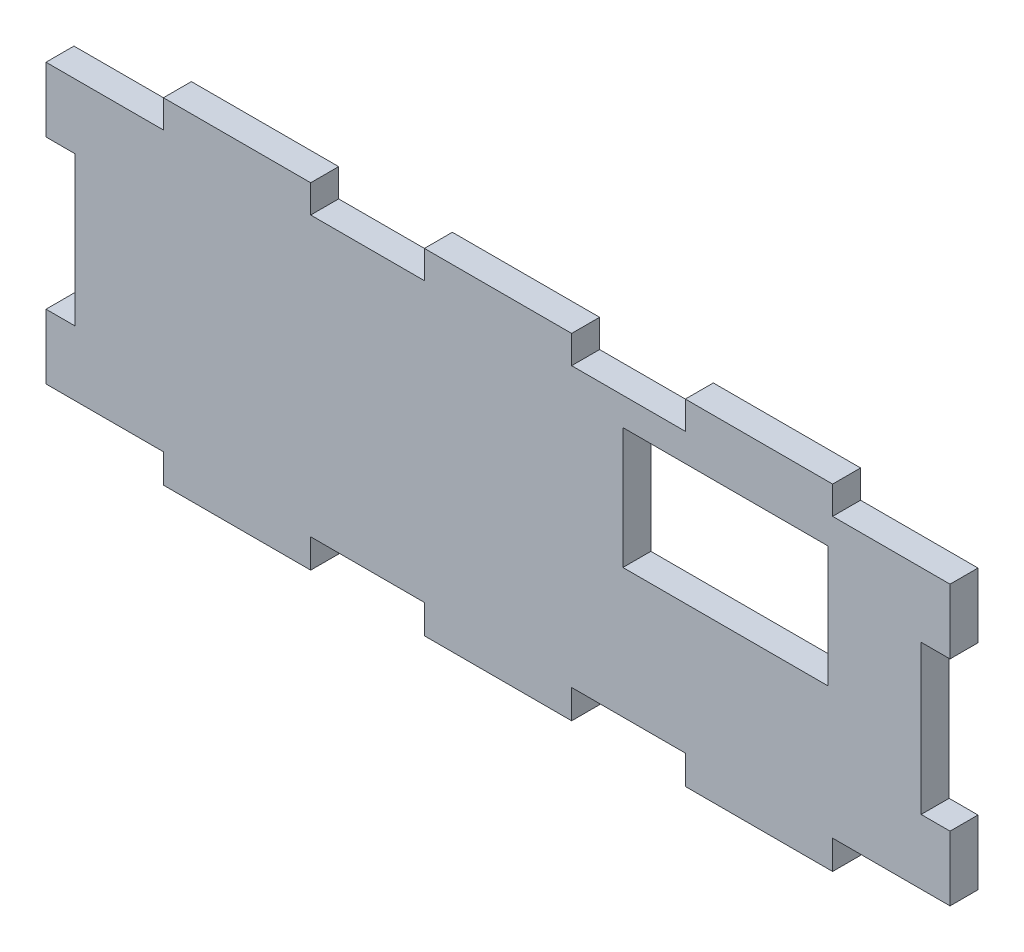
from build123d import *

# Parameters (mm, degrees)
SKETCH1_W           = 22
SKETCH1_H           = 13
BOSS_EXTRUDE1_DEPTH = 3


with BuildPart() as part:
    # Sketch1 → Boss-Extrude1 (new body)
    with BuildSketch(Plane.XY):
        Polygon((0, 29.9), (12.6, 29.9), (12.6, 32.9), (28.4, 32.9), (28.4, 29.9), (40.6, 29.9), (40.6, 32.9), (56.4, 32.9), (56.4, 29.9), (68.6, 29.9), (68.6, 32.9), (84.4, 32.9), (84.4, 29.9), (97, 29.9), (97, 22.95), (93.9, 22.95), (93.9, 6.95), (97, 6.95), (97, 0), (84.4, 0), (84.4, -3.1), (68.6, -3.1), (68.6, 0), (56.4, 0), (56.4, -3.1), (40.6, -3.1), (40.6, 0), (28.4, 0), (28.4, -3.1), (12.6, -3.1), (12.6, 0), (0, 0), (0, 6.95), (3.1, 6.95), (3.1, 22.95), (0, 22.95), align=None)
        with Locations((72.9, 20.4)):
            Rectangle(SKETCH1_W, SKETCH1_H, mode=Mode.SUBTRACT)
    extrude(amount=BOSS_EXTRUDE1_DEPTH)


solid = part.part
